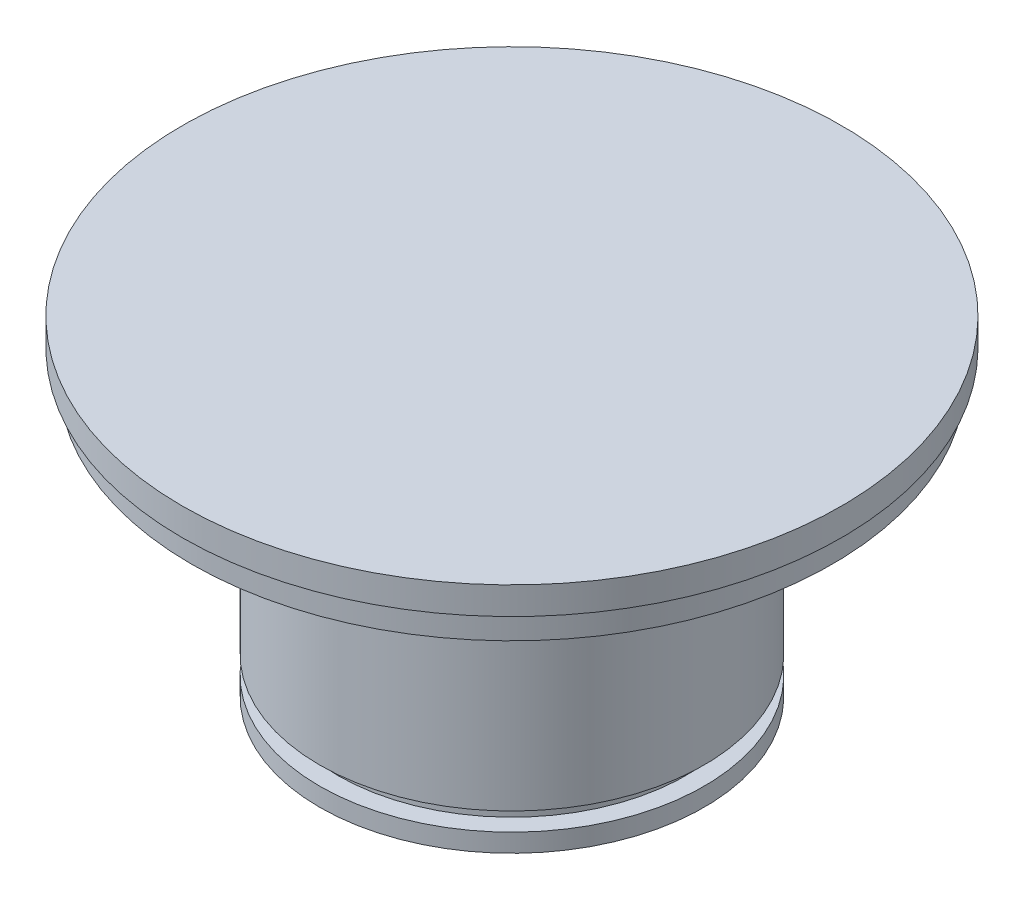
from build123d import *

# Parameters (mm, degrees)
SKETCH1_R           = 18
BOSS_EXTRUDE1_DEPTH = 1.5
SKETCH2_R           = 17.5
BOSS_EXTRUDE2_DEPTH = 1.5
SKETCH3_R           = 12
BOSS_EXTRUDE3_DEPTH = 1
SKETCH4_R           = 10.5
BOSS_EXTRUDE4_DEPTH = 12
SKETCH5_R           = 9.5
BOSS_EXTRUDE5_DEPTH = 1
SKETCH6_R           = 10.5
BOSS_EXTRUDE6_DEPTH = 1


with BuildPart() as part:
    # Sketch1 → Boss-Extrude1 (new body)
    with BuildSketch(Plane(origin=(0, 0, 0), x_dir=(1, 0, 0), z_dir=(0, 1, 0))):
        with Locations(Location((0, 0, 0), (0, 0, 270))):
            Circle(SKETCH1_R)
    extrude(amount=BOSS_EXTRUDE1_DEPTH)

    # Sketch2 → Boss-Extrude2 (add)
    with BuildSketch(Plane.XZ):
        with Locations(Location((0, 0, 0), (0, 0, 270))):
            Circle(SKETCH2_R)
    extrude(amount=BOSS_EXTRUDE2_DEPTH)

    # Sketch3 → Boss-Extrude3 (add)
    with BuildSketch(Plane.XZ.offset(1.5)):
        with Locations(Location((0, 0, 0), (0, 0, 270))):
            Circle(SKETCH3_R)
    extrude(amount=BOSS_EXTRUDE3_DEPTH)

    # Sketch4 → Boss-Extrude4 (add)
    with BuildSketch(Plane.XZ.offset(2.5)):
        with Locations(Location((0, 0, 0), (0, 0, 270))):
            Circle(SKETCH4_R)
    extrude(amount=BOSS_EXTRUDE4_DEPTH)

    # Sketch5 → Boss-Extrude5 (add)
    with BuildSketch(Plane.XZ.offset(14.5)):
        with Locations(Location((0, 0, 0), (0, 0, 270))):
            Circle(SKETCH5_R)
    extrude(amount=BOSS_EXTRUDE5_DEPTH)

    # Sketch6 → Boss-Extrude6 (add)
    with BuildSketch(Plane.XZ.offset(15.5)):
        with Locations(Location((0, 0, 0), (0, 0, 270))):
            Circle(SKETCH6_R)
    extrude(amount=BOSS_EXTRUDE6_DEPTH)


solid = part.part
